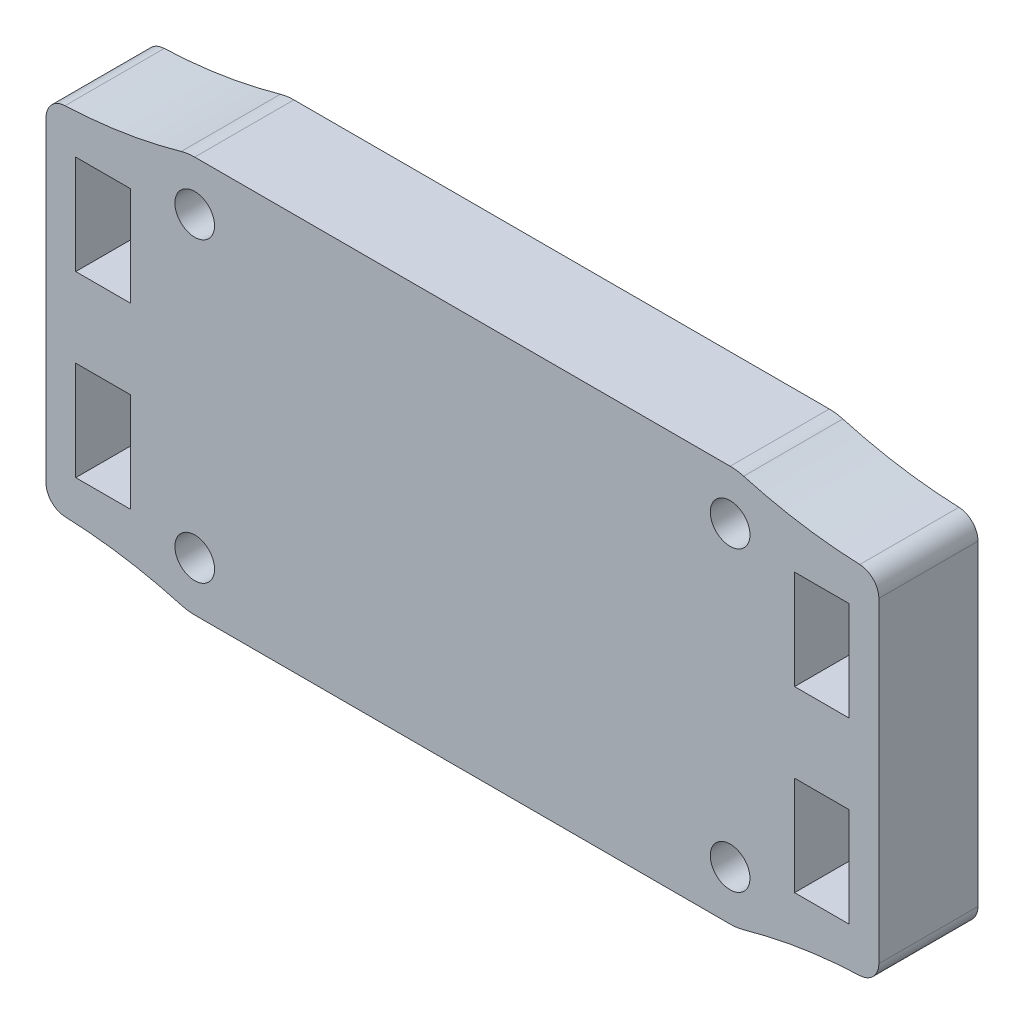
from build123d import *

# Parameters (mm, degrees)
ESQUISSE1_R        = 1
ESQUISSE1_W        = 2.75
ESQUISSE1_H        = 5
BOSS_EXTRU_1_DEPTH = 5


with BuildPart() as part:
    # Esquisse1 → Boss.-Extru.1 (new body)
    with BuildSketch(Plane.XY):
        with BuildLine():
            Line((22.775862069, -16.426262466), (-4.224137931, -16.426262466))
            ThreePointArc((-4.224137931, -16.426262466), (-4.568324536, -16.402456235), (-4.905956113, -16.331490931))
            ThreePointArc((-4.905956113, -16.331490931), (-7.806629393, -15.692620747), (-10.762599469, -15.402273545))
            ThreePointArc((-10.762599469, -15.402273545), (-11.444714623, -15.096388709), (-11.724137931, -14.403013463))
            Line((-11.724137931, -14.403013463), (-11.724137931, 1.550488531))
            ThreePointArc((-11.724137931, 1.550488531), (-11.444714623, 2.243863776), (-10.762599469, 2.549748612))
            ThreePointArc((-10.762599469, 2.549748612), (-7.806629393, 2.840095814), (-4.905956113, 3.478965998))
            ThreePointArc((-4.905956113, 3.478965998), (-4.568324536, 3.549931303), (-4.224137931, 3.573737534))
            Line((-4.224137931, 3.573737534), (22.775862069, 3.573737534))
            ThreePointArc((22.775862069, 3.573737534), (23.120048674, 3.549931303), (23.457680251, 3.478965998))
            ThreePointArc((23.457680251, 3.478965998), (26.358353531, 2.840095814), (29.314323607, 2.549748612))
            ThreePointArc((29.314323607, 2.549748612), (29.996438761, 2.243863776), (30.275862069, 1.550488531))
            Line((30.275862069, 1.550488531), (30.275862069, -14.403013463))
            ThreePointArc((30.275862069, -14.403013463), (29.996438761, -15.096388709), (29.314323607, -15.402273545))
            ThreePointArc((29.314323607, -15.402273545), (26.358353531, -15.692620747), (23.457680251, -16.331490931))
            ThreePointArc((23.457680251, -16.331490931), (23.120048674, -16.402456235), (22.775862069, -16.426262466))
        make_face()
        with Locations((-4.224137931, 1.073737534)):
            Circle(ESQUISSE1_R, mode=Mode.SUBTRACT)
        with Locations((22.775862069, 1.073737534)):
            Circle(ESQUISSE1_R, mode=Mode.SUBTRACT)
        with Locations(Location((22.775862069, -13.926262466, 0), (0, 0, 180))):
            Circle(ESQUISSE1_R, mode=Mode.SUBTRACT)
        with Locations(Location((-4.224137931, -13.926262466, 0), (0, 0, 180))):
            Circle(ESQUISSE1_R, mode=Mode.SUBTRACT)
        with Locations((27.400862069, -10.926262466)):
            Rectangle(ESQUISSE1_W, ESQUISSE1_H, mode=Mode.SUBTRACT)
        with Locations((-8.849137931, -1.926262466)):
            Rectangle(ESQUISSE1_W, ESQUISSE1_H, mode=Mode.SUBTRACT)
        with Locations((-8.849137931, -10.926262466)):
            Rectangle(ESQUISSE1_W, ESQUISSE1_H, mode=Mode.SUBTRACT)
        with Locations((27.400862069, -1.926262466)):
            Rectangle(ESQUISSE1_W, ESQUISSE1_H, mode=Mode.SUBTRACT)
    extrude(amount=BOSS_EXTRU_1_DEPTH)


solid = part.part
